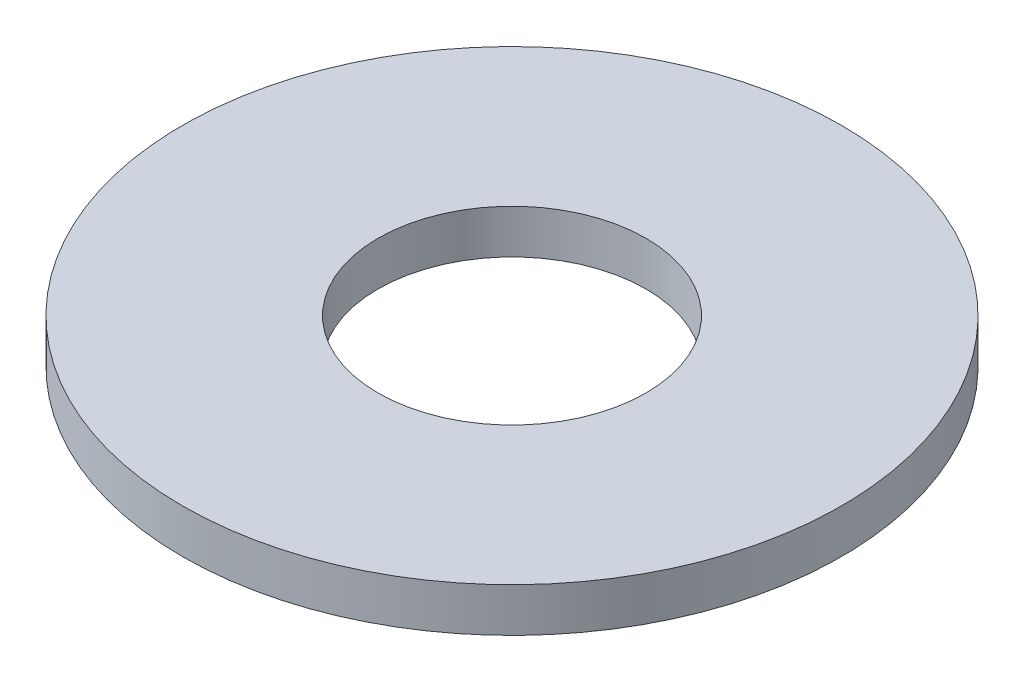
from build123d import *

# Parameters (mm, degrees)
SKETCH1_R           = 7.5
SKETCH1_R_2         = 3.05
BOSS_EXTRUDE1_DEPTH = 1


with BuildPart() as part:
    # Sketch1 → Boss-Extrude1 (new body)
    with BuildSketch(Plane(origin=(0, 0, 0), x_dir=(1, 0, 0), z_dir=(0, 1, 0))):
        with Locations(Location((0, 0, 0), (0, 0, 270))):
            Circle(SKETCH1_R)
        with Locations(Location((0, 0, 0), (0, 0, 270))):
            Circle(SKETCH1_R_2, mode=Mode.SUBTRACT)
    extrude(amount=BOSS_EXTRUDE1_DEPTH)


solid = part.part
